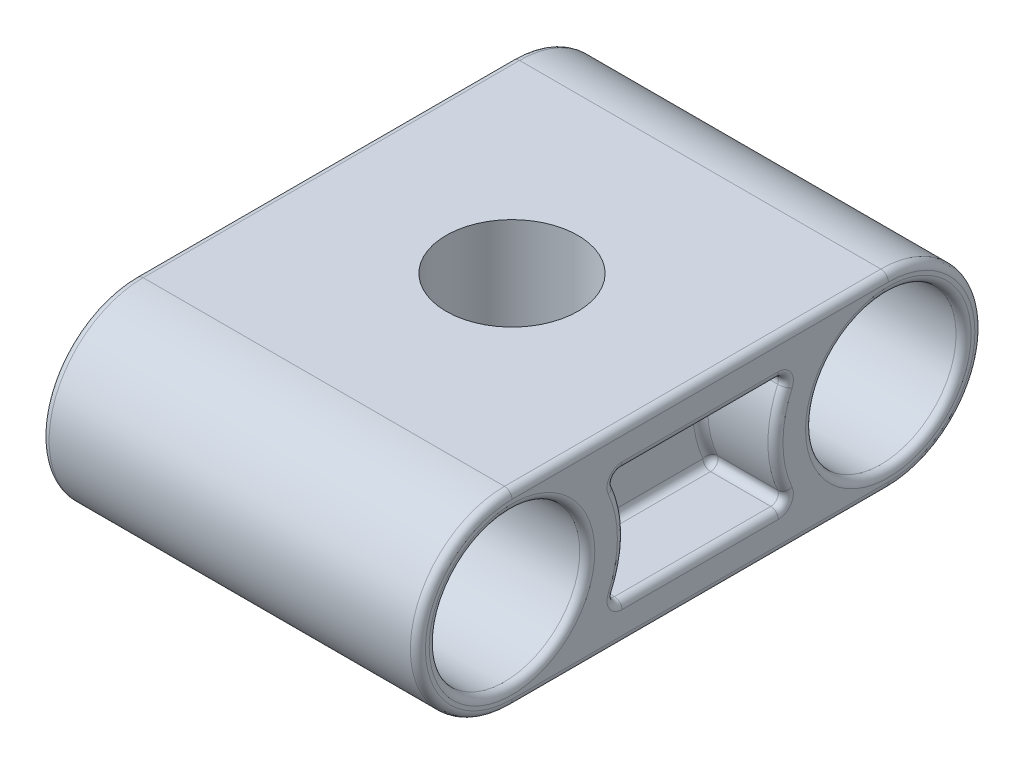
from build123d import *

# Parameters (mm, degrees)
SKETCH1_R           = 20
SKETCH1_R_2         = 20.000000000000004
BOSS_EXTRUDE1_DEPTH = 100
CUT_EXTRUDE1_DEPTH  = 20
CUT_EXTRUDE2_START  = 80
CUT_EXTRUDE2_DEPTH  = 20
SKETCH2_R           = 17.500000000000007
CUT_EXTRUDE3_DEPTH  = 135.62912017836263
FILLET1_R           = 2


with BuildPart() as part:
    # Sketch1 → Boss-Extrude1 (new body)
    with BuildSketch(Plane(origin=(0, 0, 0), x_dir=(0, 0, -1), z_dir=(1, 0, 0))):
        with BuildLine():
            Line((-50.00000000000004, 24.999999999999993), (50.00000000000004, 24.999999999999993))
            ThreePointArc((50.00000000000004, 24.999999999999993), (75.00000000000003, 0), (50.00000000000004, -24.999999999999993))
            Line((50.00000000000004, -24.999999999999993), (-50.00000000000004, -24.999999999999993))
            ThreePointArc((-50.00000000000004, -24.999999999999993), (-75.00000000000003, 3.06e-15), (-50.00000000000004, 24.999999999999993))
        make_face()
        with Locations((-50.00000000000004, 0)):
            Circle(SKETCH1_R, mode=Mode.SUBTRACT)
        with Locations((50.00000000000004, 0)):
            Circle(SKETCH1_R_2, mode=Mode.SUBTRACT)
    extrude(amount=BOSS_EXTRUDE1_DEPTH)

    # Sketch1<3> → Cut-Extrude1 (cut)
    with BuildSketch(Plane(origin=(0, 0, 0), x_dir=(0, 0, -1), z_dir=(1, 0, 0))):
        with BuildLine():
            ThreePointArc((-24.019237886466847, 15.000000000000014), (-21.022225211328, 7.7645713530758), (-20, 3.5261e-13))
            Line((-19.999999999999996, 0), (20, 0))
            ThreePointArc((20.000000000000004, 3.5616e-13), (21.022225211328006, 7.764571353075802), (24.01923788646685, 15.00000000000001))
            Line((24.01923788646685, 15.000000000000009), (-24.01923788646685, 15.000000000000009))
        make_face()
        with BuildLine():
            Line((20, 0), (-19.999999999999996, 0))
            ThreePointArc((-20, 3.5261e-13), (-21.022225211327907, -7.7645713530754525), (-24.01923788646684, -15))
            Line((-24.019237886466843, -14.999999999999995), (24.019237886466836, -14.999999999999993))
            ThreePointArc((24.019237886466843, -14.999999999999993), (21.022225211327907, -7.764571353075449), (20.000000000000004, 3.5616e-13))
        make_face()
    extrude(amount=CUT_EXTRUDE1_DEPTH, mode=Mode.SUBTRACT)

    # Sketch1<4> → Cut-Extrude2 (cut)
    with BuildSketch(Plane(origin=(0, 0, 0), x_dir=(0, 0, -1), z_dir=(1, 0, 0)).offset(CUT_EXTRUDE2_START)):
        with BuildLine():
            ThreePointArc((-24.019237886466847, 15.000000000000014), (-21.022225211328, 7.7645713530758), (-20, 3.5261e-13))
            Line((-19.999999999999996, 0), (20, 0))
            ThreePointArc((20.000000000000004, 3.5616e-13), (21.022225211328006, 7.764571353075802), (24.01923788646685, 15.00000000000001))
            Line((24.01923788646685, 15.000000000000009), (-24.01923788646685, 15.000000000000009))
        make_face()
        with BuildLine():
            Line((20, 0), (-19.999999999999996, 0))
            ThreePointArc((-20, 3.5261e-13), (-21.022225211327907, -7.7645713530754525), (-24.01923788646684, -15))
            Line((-24.019237886466843, -14.999999999999995), (24.019237886466836, -14.999999999999993))
            ThreePointArc((24.019237886466843, -14.999999999999993), (21.022225211327907, -7.764571353075449), (20.000000000000004, 3.5616e-13))
        make_face()
    extrude(amount=CUT_EXTRUDE2_DEPTH, mode=Mode.SUBTRACT)

    # Sketch2 → Cut-Extrude3 (cut, through all)
    with BuildSketch(Plane(origin=(0, 24.999999999999993, 0), x_dir=(1, 0, 0), z_dir=(0, 1, 0))):
        with Locations(Location((50, 0, 0), (0, 0, 270))):
            Circle(SKETCH2_R)
    extrude(amount=-CUT_EXTRUDE3_DEPTH, mode=Mode.SUBTRACT)

    # Fillet1
    fillet1_edges = [part.edges().sort_by_distance(p)[0] for p in [
        (0, 2.45e-15, -30.00000000000004),
        (100, 2.45e-15, 70.00000000000004),
        (100, -24.999999999999993, 0),
        (100, 5.31e-15, -75.00000000000003),
        (0, 1.11e-14, 20.000000000000004),
        (10, 15.00000000000001, 24.019237886466847),
        (0, -14.999999999999993, 3.55e-15),
        (10, -14.999999999999996, 24.01923788646684),
        (20, 8.22e-15, -20),
        (10, -14.999999999999993, -24.01923788646684),
        (20, 15.000000000000009, 0),
        (10, 15.00000000000001, -24.01923788646685),
        (20, 5.33e-15, 19.999999999999996),
        (20, -14.999999999999993, 3.55e-15),
        (0, 15.000000000000009, 0),
        (0, 9.77e-15, -20),
        (100, 24.999999999999993, 0),
        (100, -2.64e-15, 75.00000000000003),
        (80, 15.000000000000009, 0),
        (90, 15.00000000000001, 24.019237886466847),
        (100, 8.22e-15, -20),
        (90, 15.00000000000001, -24.01923788646685),
        (100, -14.999999999999993, 3.55e-15),
        (90, -14.999999999999993, -24.01923788646684),
        (100, 5.33e-15, 19.999999999999996),
        (90, -14.999999999999996, 24.01923788646684),
        (80, 9.77e-15, -20),
        (80, -14.999999999999993, 3.55e-15),
        (80, 1.11e-14, 20.000000000000004),
        (100, 15.000000000000009, 0),
        (100, 2.45e-15, -30.00000000000004),
        (0, -2.64e-15, 75.00000000000003),
        (0, 24.999999999999993, 0),
        (0, 5.31e-15, -75.00000000000003),
        (0, -24.999999999999993, 0),
        (0, 2.45e-15, 70.00000000000004),
    ]]
    fillet(fillet1_edges, radius=FILLET1_R)


solid = part.part
